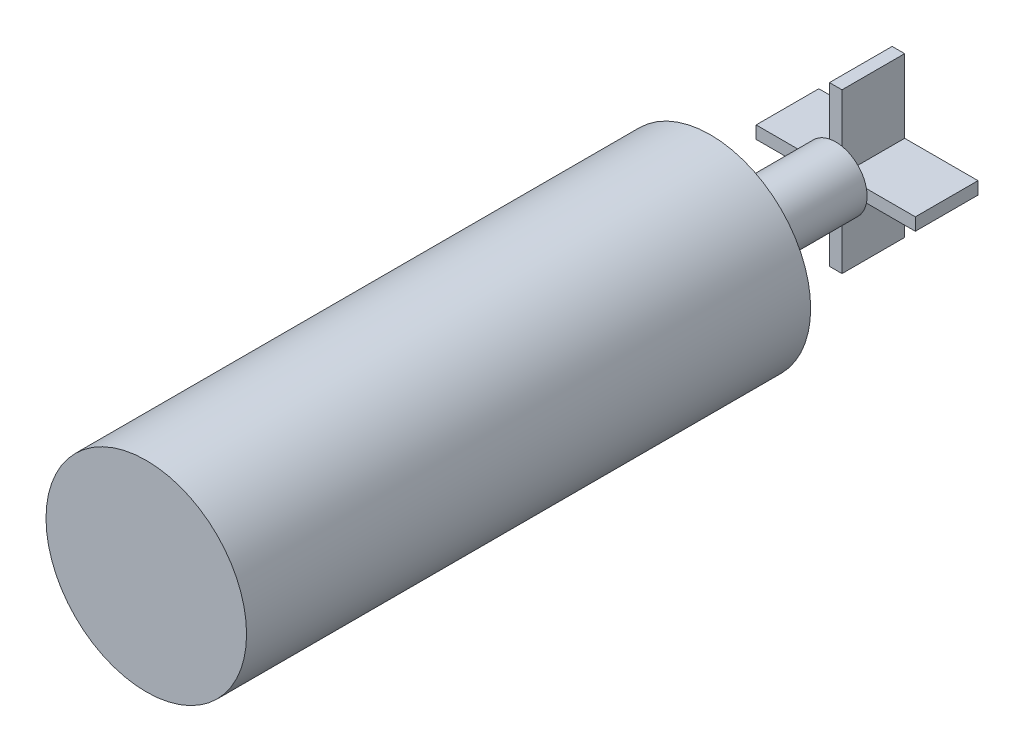
from build123d import *

# Parameters (mm, degrees)
SKETCH2_R           = 16
BOSS_EXTRUDE1_DEPTH = 90
SKETCH3_R           = 5
BOSS_EXTRUDE2_DEPTH = 20
BOSS_EXTRUDE4_DEPTH = 10


with BuildPart() as part:
    # Sketch2 → Boss-Extrude1 (new body)
    with BuildSketch(Plane.XY):
        with Locations(Location((0, 0, 0), (0, 0, 180))):
            Circle(SKETCH2_R)
    extrude(amount=BOSS_EXTRUDE1_DEPTH)

    # Sketch3 → Boss-Extrude2 (add)
    with BuildSketch(Plane(origin=(0, 0, 0), x_dir=(-1, 0, 0), z_dir=(0, 0, -1))):
        Circle(SKETCH3_R)
    extrude(amount=BOSS_EXTRUDE2_DEPTH)

    # Sketch5 → Boss-Extrude4 (add)
    with BuildSketch(Plane(origin=(0, 0, -20), x_dir=(-1, 0, 0), z_dir=(0, 0, -1))):
        Polygon((1, 1), (12.7, 1), (12.7, -1), (1, -1), (1, -12.7), (-1, -12.7), (-1, -1), (-12.7, -1), (-12.7, 1), (-1, 1), (-1, 12.7), (1, 12.7), align=None)
    extrude(amount=BOSS_EXTRUDE4_DEPTH)


solid = part.part
